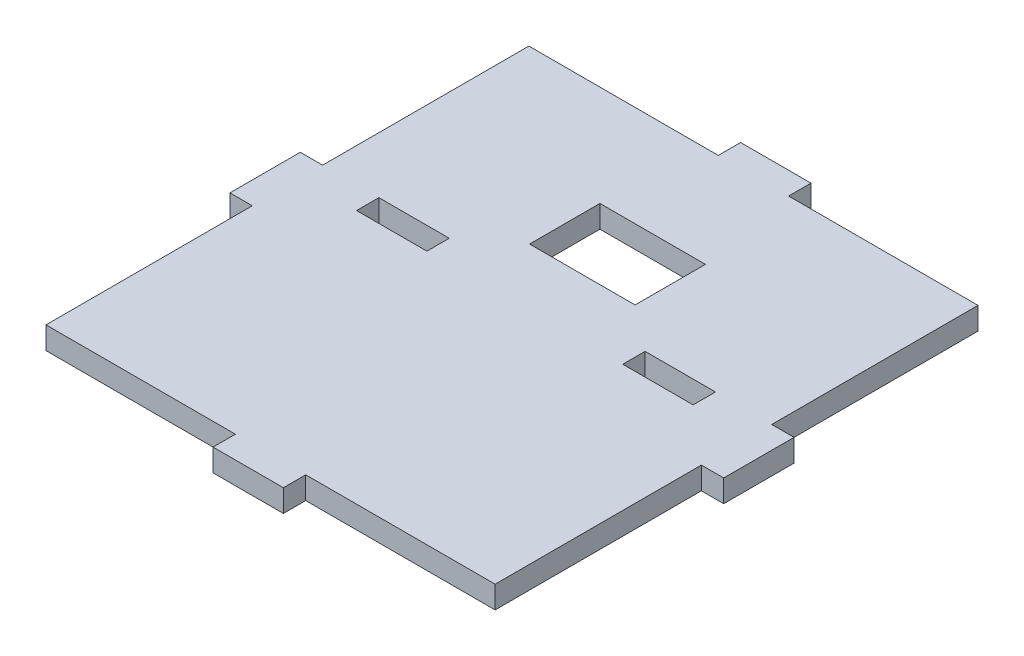
from build123d import *

# Parameters (mm, degrees)
BOSS_EXTRUDE1_DEPTH = 12.7
SKETCH2_W           = 40
SKETCH2_H           = 12.7
SKETCH2_W_2         = 60
SKETCH2_H_2         = 40
CUT_EXTRUDE1_DEPTH  = 12.7


with BuildPart() as part:
    # Sketch1 → Boss-Extrude1 (new body)
    with BuildSketch(Plane(origin=(0, 0, 0), x_dir=(1, 0, 0), z_dir=(0, 1, 0))):
        Polygon((-127.7, -137.3), (-20, -137.3), (-20, -150), (20, -150), (20, -137.3), (127.7, -137.3), (127.7, -20), (140.4, -20), (140.4, 20), (127.7, 20), (127.7, 137.3), (20, 137.3), (20, 150), (-20, 150), (-20, 137.3), (-127.7, 137.3), (-127.7, 20), (-140.4, 20), (-140.4, -20), (-127.7, -20), align=None)
    extrude(amount=BOSS_EXTRUDE1_DEPTH)

    # Sketch2 → Cut-Extrude1 (cut)
    with BuildSketch(Plane(origin=(0, 12.7, 0), x_dir=(1, 0, 0), z_dir=(0, 1, 0))):
        with Locations((-75.7, 13.65)):
            Rectangle(SKETCH2_W, SKETCH2_H)
        with Locations((75.7, 13.65)):
            Rectangle(SKETCH2_W, SKETCH2_H)
        with Locations((0, 60)):
            Rectangle(SKETCH2_W_2, SKETCH2_H_2)
    extrude(amount=-CUT_EXTRUDE1_DEPTH, mode=Mode.SUBTRACT)


solid = part.part
